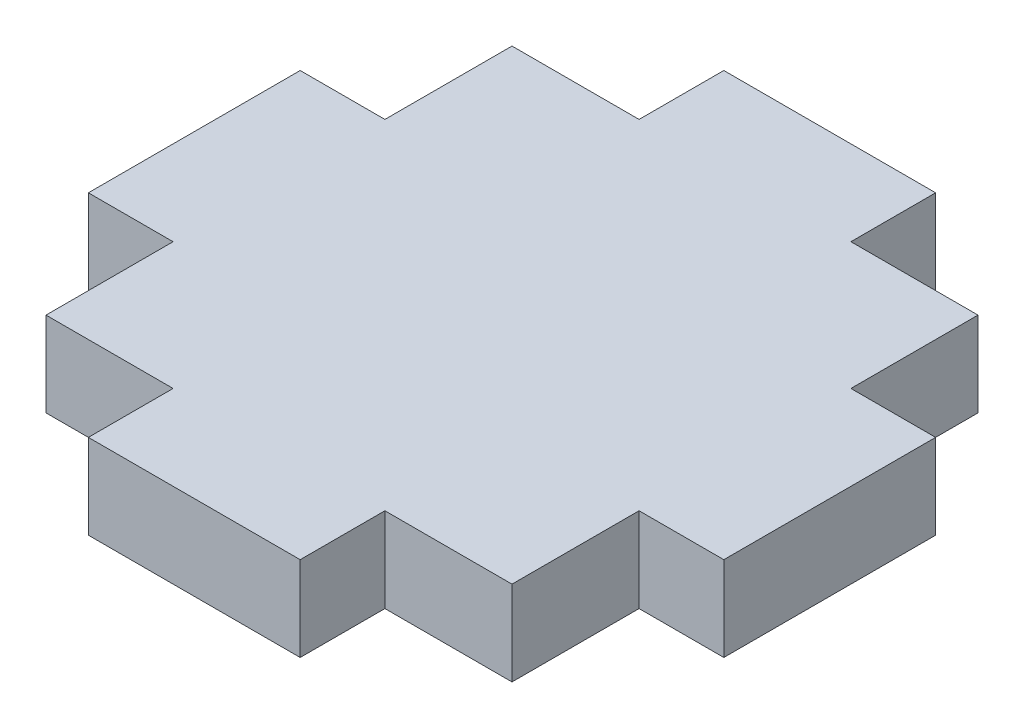
from build123d import *

# Parameters (mm, degrees)
SKETCH1_W           = 10
SKETCH1_H           = 4
SKETCH1_W_2         = 4
SKETCH1_H_2         = 10
BOSS_EXTRUDE1_DEPTH = 4


with BuildPart() as part:
    # Sketch1 → Boss-Extrude1 (new body)
    with BuildSketch(Plane(origin=(0, 0, 0), x_dir=(1, 0, 0), z_dir=(0, 1, 0))):
        Polygon((4, 10), (4, 4), (10, 4), (20, 4), (26, 4), (26, 10), (26, 20), (26, 26), (20, 26), (10, 26), (4, 26), (4, 20), align=None)
        with Locations((15, 2)):
            Rectangle(SKETCH1_W, SKETCH1_H)
        with Locations((28, 15)):
            Rectangle(SKETCH1_W_2, SKETCH1_H_2)
        with Locations((15, 28)):
            Rectangle(SKETCH1_W, SKETCH1_H)
        with Locations((2, 15)):
            Rectangle(SKETCH1_W_2, SKETCH1_H_2)
    extrude(amount=BOSS_EXTRUDE1_DEPTH)


solid = part.part
